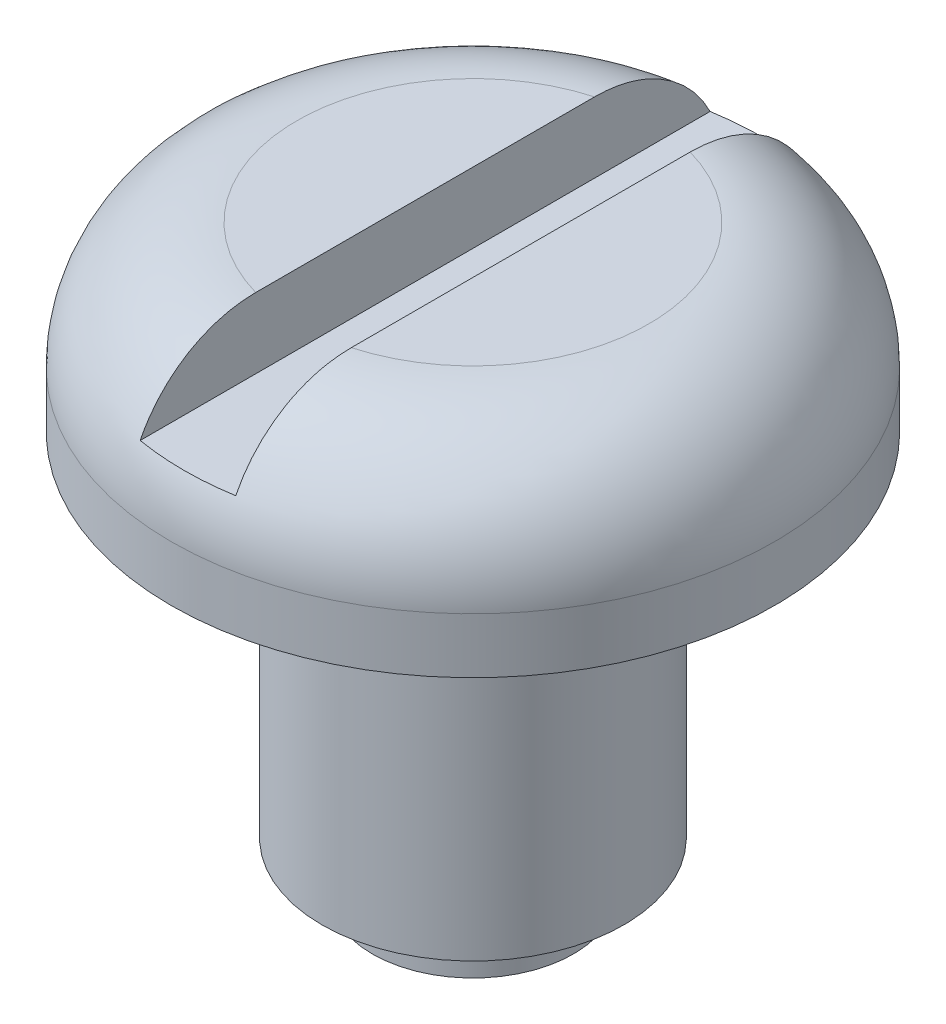
from build123d import *

# Parameters (mm, degrees)
SKETCH1_R           = 2
BOSS_EXTRUDE1_DEPTH = 11.6
SKETCH1_3_R         = 3
SKETCH1_3_R_2       = 2
BOSS_EXTRUDE2_DEPTH = 10.6
SKETCH1_4_R         = 6
SKETCH1_4_R_2       = 3
BOSS_EXTRUDE3_DEPTH = 3.6
FILLET1_R           = 2.5
SKETCH2_W           = 1.9
SKETCH2_H           = 12.487967684
CUT_EXTRUDE1_DEPTH  = 1.4


with BuildPart() as part:
    # Sketch1 → Boss-Extrude1 (new body)
    with BuildSketch(Plane(origin=(0, 0, 0), x_dir=(1, 0, 0), z_dir=(0, 1, 0))):
        Circle(SKETCH1_R)
    extrude(amount=-BOSS_EXTRUDE1_DEPTH)

    # Sketch1<3> → Boss-Extrude2 (add)
    with BuildSketch(Plane(origin=(0, 0, 0), x_dir=(1, 0, 0), z_dir=(0, 1, 0))):
        Circle(SKETCH1_3_R)
        Circle(SKETCH1_3_R_2, mode=Mode.SUBTRACT)
    extrude(amount=-BOSS_EXTRUDE2_DEPTH)

    # Sketch1<4> → Boss-Extrude3 (add)
    with BuildSketch(Plane(origin=(0, 0, 0), x_dir=(1, 0, 0), z_dir=(0, 1, 0))):
        Circle(SKETCH1_4_R)
        Circle(SKETCH1_4_R_2, mode=Mode.SUBTRACT)
    extrude(amount=-BOSS_EXTRUDE3_DEPTH)

    # Fillet1
    fillet1_edges = [part.edges().sort_by_distance(p)[0] for p in [
        (-6, 0, 0),
    ]]
    fillet(fillet1_edges, radius=FILLET1_R)

    # Sketch2 → Cut-Extrude1 (cut)
    with BuildSketch(Plane(origin=(0, 0, 0), x_dir=(1, 0, 0), z_dir=(0, 1, 0))):
        Rectangle(SKETCH2_W, SKETCH2_H)
    extrude(amount=-CUT_EXTRUDE1_DEPTH, mode=Mode.SUBTRACT)


solid = part.part
